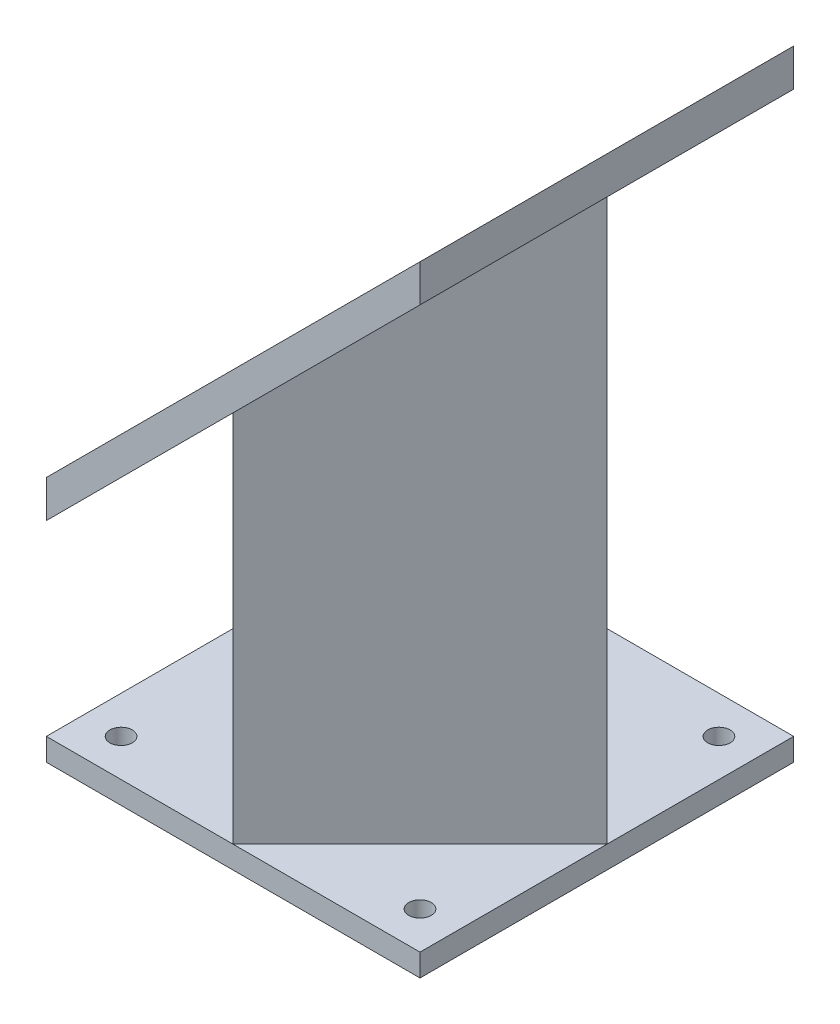
from build123d import *

# Parameters (mm, degrees)
SKETCH1_W           = 50
SKETCH1_H           = 50
SKETCH1_R           = 1.5
BOSS_EXTRUDE1_DEPTH = 3
BOSS_EXTRUDE2_DEPTH = 75
CUT_EXTRUDE1_DEPTH  = 96.963534741
SKETCH4_W           = 50
SKETCH4_H           = 70.710678118
BOSS_EXTRUDE3_DEPTH = 5


with BuildPart() as part:
    # Sketch1 → Boss-Extrude1 (new body)
    with BuildSketch(Plane(origin=(0, 0, 0), x_dir=(1, 0, 0), z_dir=(0, 1, 0))):
        Rectangle(SKETCH1_W, SKETCH1_H)
        with Locations(Location((-20, -20, 0), (0, 0, 270))):
            Circle(SKETCH1_R, mode=Mode.SUBTRACT)
        with Locations(Location((-20, 20, 0), (0, 0, 270))):
            Circle(SKETCH1_R, mode=Mode.SUBTRACT)
        with Locations(Location((20, 20, 0), (0, 0, 270))):
            Circle(SKETCH1_R, mode=Mode.SUBTRACT)
        with Locations(Location((20, -20, 0), (0, 0, 270))):
            Circle(SKETCH1_R, mode=Mode.SUBTRACT)
    extrude(amount=BOSS_EXTRUDE1_DEPTH)

    # Sketch2 → Boss-Extrude2 (add)
    with BuildSketch(Plane(origin=(0, 3, 0), x_dir=(1, 0, 0), z_dir=(0, 1, 0))):
        Polygon((0, 25), (-25, 0), (0, -25), (25, 0), align=None)
        Polygon((0, 17.928932188), (-17.928932188, 0), (0, -17.928932188), (17.928932188, 0), align=None, mode=Mode.SUBTRACT)
    extrude(amount=BOSS_EXTRUDE2_DEPTH)

    # Sketch3 → Cut-Extrude1 (cut, through all)
    with BuildSketch(Plane.XY.offset(25)):
        Polygon((25, 78), (-25, 78), (-25, 28), align=None)
    extrude(amount=-CUT_EXTRUDE1_DEPTH, mode=Mode.SUBTRACT)

    # Sketch4 → Boss-Extrude3 (add, along a direction that is not the sketch's normal)
    with BuildSketch(Plane(origin=(-26.5, 26.5, 0), x_dir=(0, 0, 1), z_dir=(-0.7071067811865438, 0.7071067811865513, 0))):
        with Locations((0, 37.476659403)):
            Rectangle(SKETCH4_W, SKETCH4_H)
        Polygon((-17.928932188, 37.476659403), (0, 62.831998462), (17.928932188, 37.476659403), (0, 12.121320344), align=None, mode=Mode.SUBTRACT)
    extrude(amount=BOSS_EXTRUDE3_DEPTH, dir=(0, 1, 0))


solid = part.part
